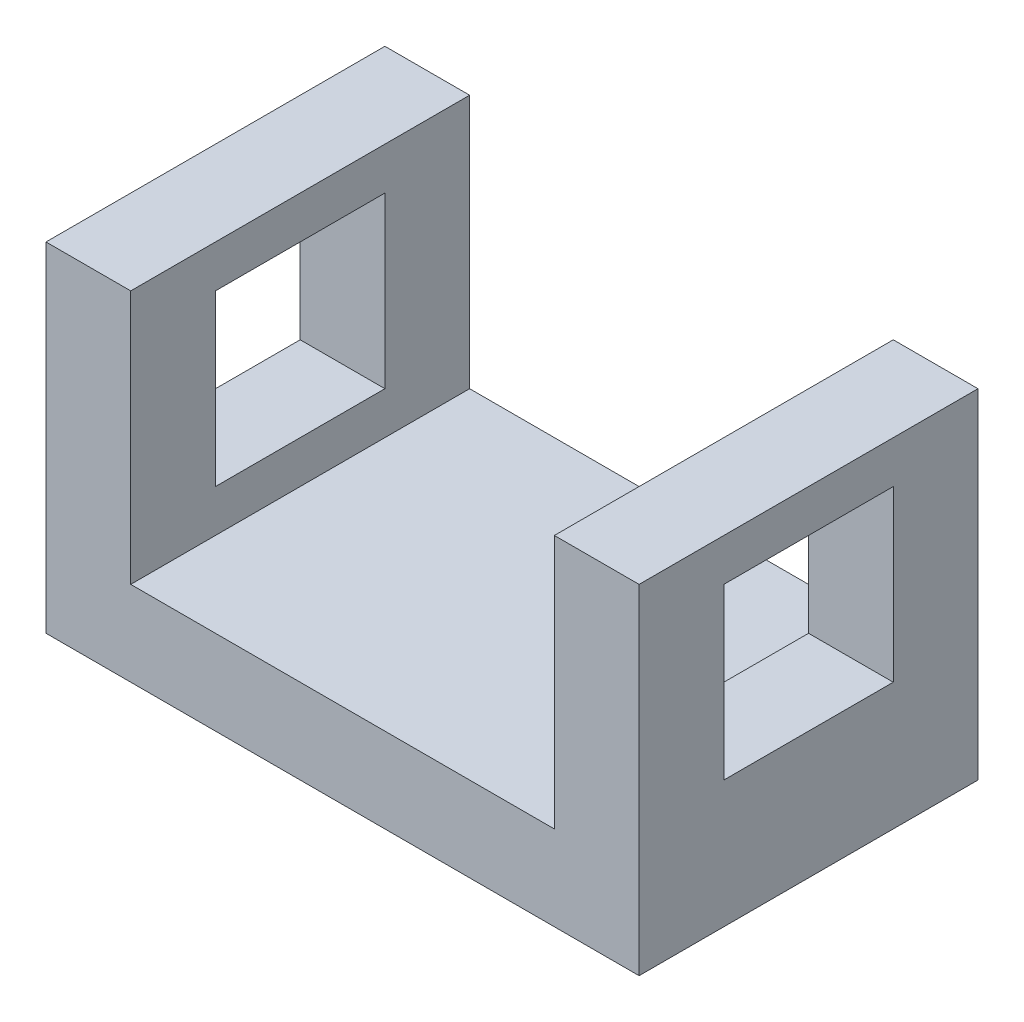
from build123d import *

# Parameters (mm, degrees)
BOSS_EXTRUDE1_DEPTH = 25.4
SKETCH3_W           = 25.4
SKETCH3_H           = 25.4
CUT_EXTRUDE1_DEPTH  = 76.2


with BuildPart() as part:
    # Sketch1 → Boss-Extrude1 (new, symmetric)
    with BuildSketch(Plane.XY):
        Polygon((-62.47027027, -14.909430353), (26.42972973, -14.909430353), (26.42972973, 35.890569647), (13.72972973, 35.890569647), (13.72972973, -2.209430353), (-49.77027027, -2.209430353), (-49.77027027, 35.890569647), (-62.47027027, 35.890569647), align=None)
    extrude(amount=BOSS_EXTRUDE1_DEPTH, both=True)

    # Sketch3 → Cut-Extrude1 (cut, symmetric)
    with BuildSketch(Plane(origin=(0, 0, 0), x_dir=(0, 0, -1), z_dir=(1, 0, 0))):
        with Locations((0, 16.840569647)):
            Rectangle(SKETCH3_W, SKETCH3_H)
    extrude(amount=CUT_EXTRUDE1_DEPTH, both=True, mode=Mode.SUBTRACT)


solid = part.part
